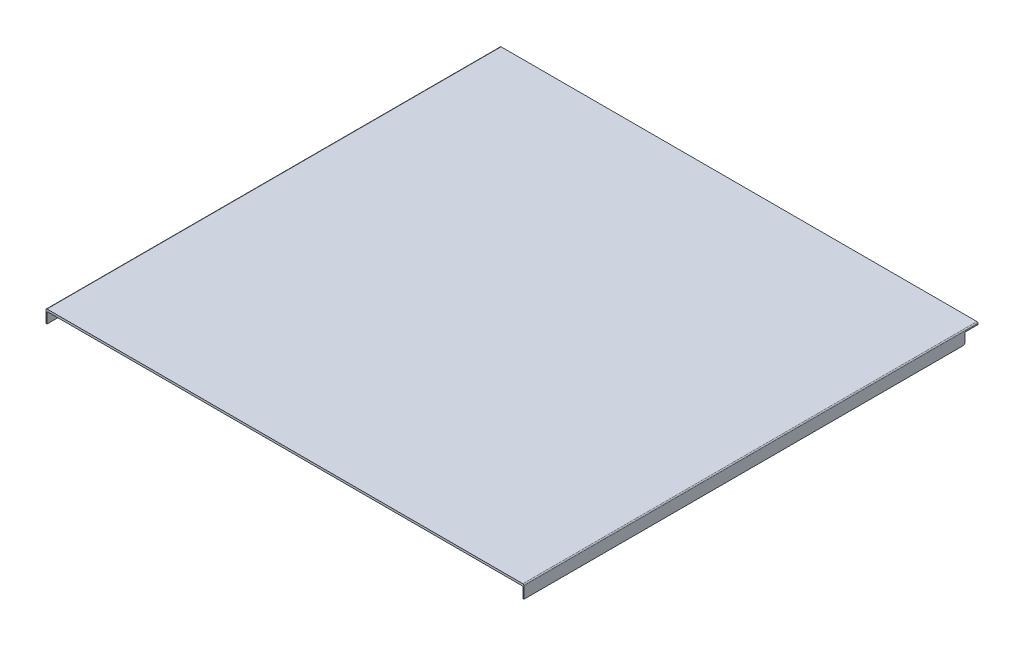
from build123d import *

# Parameters (mm, degrees)
SKETCH1_W           = 442
SKETCH1_H           = 420
BOSS_EXTRUDE1_DEPTH = 2
SKETCH2_W           = 1
SKETCH2_H           = 408
BOSS_EXTRUDE2_DEPTH = 10
FILLET1_R           = 2
FILLET2_R           = 0.5
FILLET3_R           = 1
FILLET4_R           = 0.5


with BuildPart() as part:
    # Sketch1 → Boss-Extrude1 (new body)
    with BuildSketch(Plane(origin=(0, 0, 0), x_dir=(1, 0, 0), z_dir=(0, 1, 0))):
        Rectangle(SKETCH1_W, SKETCH1_H)
    extrude(amount=BOSS_EXTRUDE1_DEPTH)

    # Sketch2 → Boss-Extrude2 (add)
    with BuildSketch(Plane.XZ):
        with Locations((220.5, 6)):
            Rectangle(SKETCH2_W, SKETCH2_H)
        with Locations((-220.5, 6)):
            Rectangle(SKETCH2_W, SKETCH2_H)
    extrude(amount=BOSS_EXTRUDE2_DEPTH)

    # Fillet1
    fillet1_edges = [part.edges().sort_by_distance(p)[0] for p in [
        (-220.5, -10, -198),
        (220.5, -10, -198),
    ]]
    fillet(fillet1_edges, radius=FILLET1_R)

    # Fillet2
    fillet2_edges = [part.edges().sort_by_distance(p)[0] for p in [
        (-220.5, 0, -198),
        (220.5, 0, -198),
    ]]
    fillet(fillet2_edges, radius=FILLET2_R)

    # Fillet3
    fillet3_edges = [part.edges().sort_by_distance(p)[0] for p in [
        (-221, 2, 0),
        (221, 2, 0),
    ]]
    fillet(fillet3_edges, radius=FILLET3_R)

    # Fillet4
    fillet4_edges = [part.edges().sort_by_distance(p)[0] for p in [
        (-220, 0, 5.75),
        (220, 0, 5.75),
    ]]
    fillet(fillet4_edges, radius=FILLET4_R)


solid = part.part
